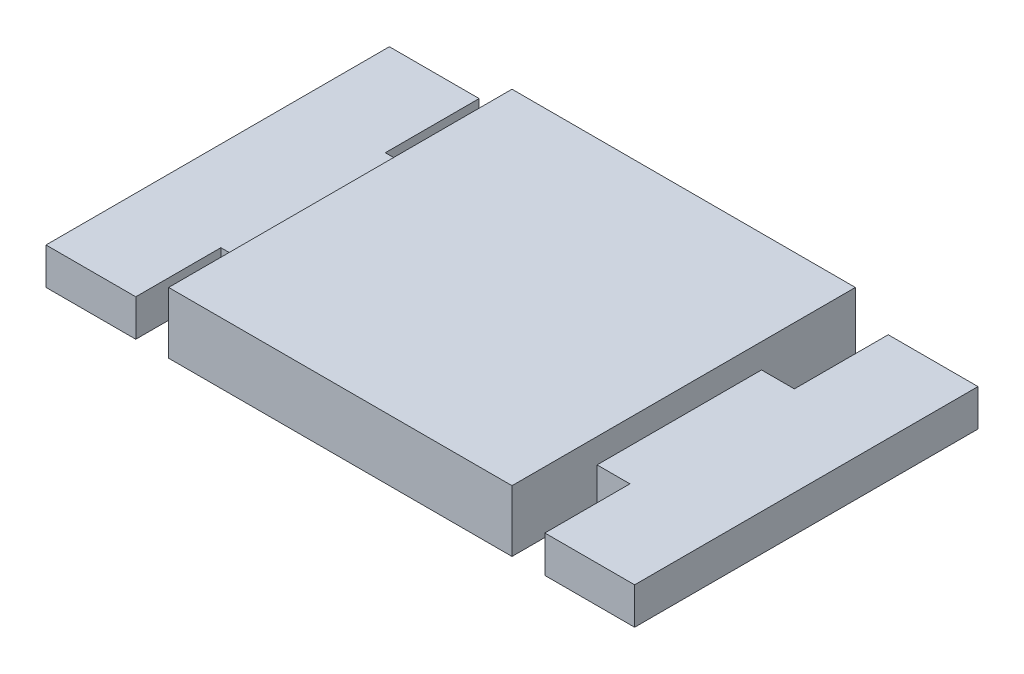
from build123d import *

# Parameters (mm, degrees)
EXTRUDE_1_DEPTH = 3
SKETCH_3_W      = 28
SKETCH_3_H      = 28
EXTRUDE_2_DEPTH = 1
SKETCH_4_W      = 28
SKETCH_4_H      = 28
EXTRUDE_3_DEPTH = 1


with BuildPart() as part:
    # 草图2 → 凸台-拉伸1 (new body)
    with BuildSketch(Plane(origin=(0, 0, 0), x_dir=(1, 0, 0), z_dir=(0, 1, 0))):
        Polygon((0, 9.283892138), (-2.678979425, 9.283892138), (-2.678979425, 16.936687797), (-10, 16.936687797), (-10, -11.063312203), (-2.678979425, -11.063312203), (-2.678979425, -4.12513502), (0, -4.12513502), (0, -11.063312203), (28, -11.063312203), (28, -4.12513502), (30.678979425, -4.12513502), (30.678979425, -11.063312203), (38, -11.063312203), (38, 16.936687797), (30.678979425, 16.936687797), (30.678979425, 9.283892138), (28, 9.283892138), (28, 16.936687797), (0, 16.936687797), align=None)
    extrude(amount=EXTRUDE_1_DEPTH)

    # 草图3 → 凸台-拉伸2 (add)
    with BuildSketch(Plane(origin=(0, 3, 0), x_dir=(1, 0, 0), z_dir=(0, 1, 0))):
        with Locations((14, 2.936687797)):
            Rectangle(SKETCH_3_W, SKETCH_3_H)
    extrude(amount=EXTRUDE_2_DEPTH)

    # 草图4 → 凸台-拉伸3 (add)
    with BuildSketch(Plane(origin=(0, 4, 0), x_dir=(1, 0, 0), z_dir=(0, 1, 0))):
        with Locations((14, 2.936687797)):
            Rectangle(SKETCH_4_W, SKETCH_4_H)
    extrude(amount=EXTRUDE_3_DEPTH)


solid = part.part
